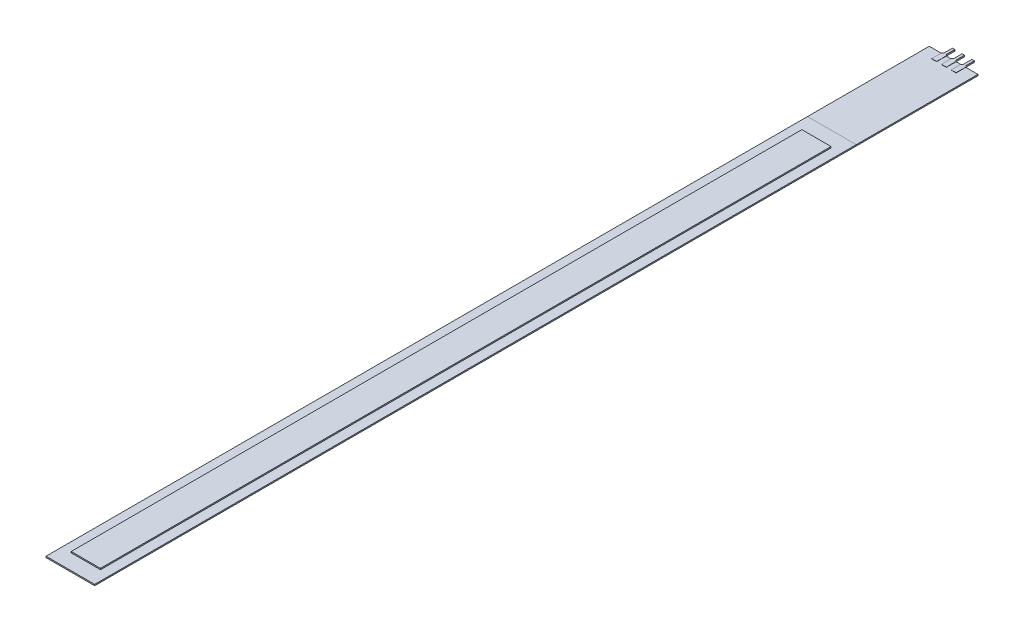
from build123d import *

# Parameters (mm, degrees)
SKETCH1_W           = 10
SKETCH1_H           = 156.35
BOSS_EXTRUDE1_DEPTH = 0.255
SKETCH2_W           = 6
SKETCH2_H           = 150
BOSS_EXTRUDE2_DEPTH = 0.255
SKETCH3_W           = 10
SKETCH3_H           = 25
BOSS_EXTRUDE4_DEPTH = 0.255
BOSS_EXTRUDE5_DEPTH = 0.3


with BuildPart() as part:
    # Sketch1 → Boss-Extrude1 (new body)
    with BuildSketch(Plane(origin=(0, 0, 0), x_dir=(1, 0, 0), z_dir=(0, 1, 0))):
        Rectangle(SKETCH1_W, SKETCH1_H)
    extrude(amount=BOSS_EXTRUDE1_DEPTH)

    # Sketch2 → Boss-Extrude2 (add)
    with BuildSketch(Plane(origin=(0, 0.255, 0), x_dir=(1, 0, 0), z_dir=(0, 1, 0))):
        with Locations((0, 0.005)):
            Rectangle(SKETCH2_W, SKETCH2_H)
    extrude(amount=BOSS_EXTRUDE2_DEPTH)


with BuildPart() as body_2:
    # Sketch3 → Boss-Extrude4 (new body)
    with BuildSketch(Plane(origin=(0, 0, 0), x_dir=(1, 0, 0), z_dir=(0, 1, 0))):
        with Locations((0, 90.675)):
            Rectangle(SKETCH3_W, SKETCH3_H)
    extrude(amount=BOSS_EXTRUDE4_DEPTH)

    # Sketch6 → Boss-Extrude5 (add)
    with BuildSketch(Plane(origin=(0, 0, 0), x_dir=(1, 0, 0), z_dir=(0, 1, 0))):
        Polygon((-0.5, 101.175), (0.5, 101.175), (0.5, 103.175), (0.25, 103.425), (0.25, 105.175), (-0.25, 105.175), (-0.25, 103.425), (-0.5, 103.175), align=None)
        Polygon((2.25, 105.175), (2.25, 103.425), (2.5, 103.175), (2.5, 101.175), (1.5, 101.175), (1.5, 103.175), (1.75, 103.425), (1.75, 105.175), align=None)
        Polygon((-1.75, 105.175), (-2.25, 105.175), (-2.25, 103.425), (-2.5, 103.175), (-2.5, 101.175), (-1.5, 101.175), (-1.5, 103.175), (-1.75, 103.425), align=None)
    extrude(amount=BOSS_EXTRUDE5_DEPTH)


solid = Compound([part.part, body_2.part])
